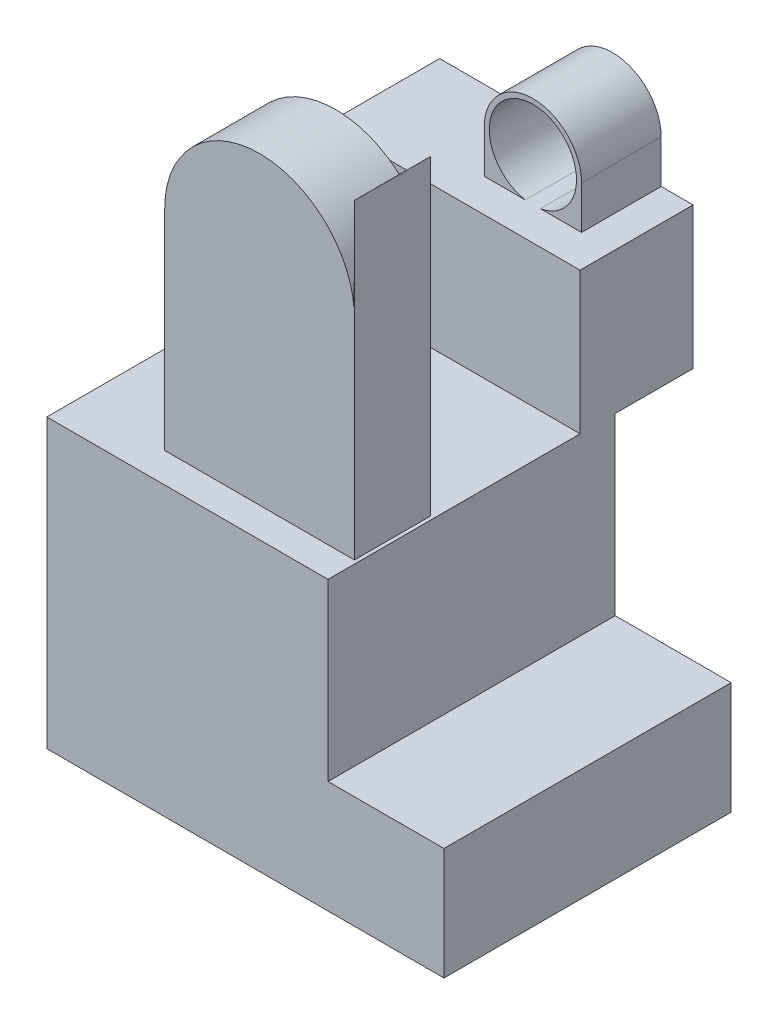
from build123d import *

# Parameters (mm, degrees)
EXTRUDE_1_DEPTH     = 72.39
SKETCH_2_W          = 63.894569667
SKETCH_2_H          = 50.584743582
EXTRUDE_2_DEPTH     = 35.72348927
SKETCH_3_W          = 47.81706323
SKETCH_3_H          = 19.199275388
EXTRUDE_4_DEPTH     = 78.486
CUT_EXTRUDE_4_DEPTH = 22.098
SKETCH_7_W          = 85.131498904
SKETCH_7_H          = 43.590498022
CUT_EXTRUDE_5_DEPTH = 22.098
EXTRUDE_5_DEPTH     = 20.066


with BuildPart() as part:
    # 草图1 → 凸台-拉伸1 (new body)
    with BuildSketch(Plane.XY):
        Polygon((30.681441224, -0.764247788), (59.9139191, -0.764247788), (59.9139191, -29.041415929), (-40.202541077, -29.041415929), (-40.202541077, -0.764247788), (-40.202541077, 43.371061947), (30.681441224, 43.371061947), align=None)
    extrude(amount=EXTRUDE_1_DEPTH)

    # 草图2 → 凸台-拉伸2 (add)
    with BuildSketch(Plane(origin=(0, 43.371061947, 0), x_dir=(1, 0, 0), z_dir=(0, 1, 0))):
        with Locations((-1.26584361, 16.441925792)):
            Rectangle(SKETCH_2_W, SKETCH_2_H)
    extrude(amount=EXTRUDE_2_DEPTH)

    # 草图3 → 凸台-拉伸4 (add)
    with BuildSketch(Plane(origin=(0, 43.371061947, 0), x_dir=(1, 0, 0), z_dir=(0, 1, 0))):
        with Locations((5.873027985, -55.236552657)):
            Rectangle(SKETCH_3_W, SKETCH_3_H)
    extrude(amount=EXTRUDE_4_DEPTH)

    # 草图6 → 切除-拉伸4 (cut)
    with BuildSketch(Plane.XY.offset(64.836190351)):
        with BuildLine():
            Line((-18.03550363, 121.857061947), (-18.03550363, 96.233075723))
            ThreePointArc((-18.03550363, 96.233075723), (5.04667963, 120.12732257), (29.724437597, 97.884784986))
            Line((29.724437597, 97.884784986), (29.774943726, 121.857061947))
            Line((29.774943726, 121.857061947), (-18.03550363, 121.857061947))
        make_face()
    extrude(amount=-CUT_EXTRUDE_4_DEPTH, mode=Mode.SUBTRACT)

    # 草图7 → 切除-拉伸5 (cut)
    with BuildSketch(Plane(origin=(0, 0, -41.734297583), x_dir=(-1, 0, 0), z_dir=(0, 0, -1))):
        with Locations((8.884308228, 58.531001223)):
            Rectangle(SKETCH_7_W, SKETCH_7_H)
    extrude(amount=-CUT_EXTRUDE_5_DEPTH, mode=Mode.SUBTRACT)

    # 草图8 → 凸台-拉伸5 (add)
    with BuildSketch(Plane(origin=(0, 0, -19.636297583), x_dir=(-1, 0, 0), z_dir=(0, 0, -1))):
        with BuildLine():
            ThreePointArc((1.878708632, 90.752463726), (-10.775595888, 102.192073522), (-22.633627477, 89.928991445))
            Line((-22.633627477, 89.928991445), (-22.633627477, 79.094551217))
            Line((-22.633627477, 79.094551217), (-12.26491781, 79.094551217))
            ThreePointArc((-12.26491781, 79.094551217), (-17.43772835, 98.352594999), (0.636372523, 89.928991445))
            ThreePointArc((0.636372523, 89.928991445), (-1.940023923, 82.854890572), (-8.462337143, 79.094551217))
            Line((-8.462337143, 79.094551217), (1.899704254, 79.094551217))
            Line((1.899704254, 79.094551217), (1.881595314, 89.149620673))
            Line((1.881595314, 89.149620673), (1.878708632, 90.752463726))
        make_face()
        with BuildLine():
            Line((-12.26491781, 79.094551217), (-22.633627477, 79.094551217))
            Line((-22.633627477, 79.094551217), (-22.633627477, 75.391965029))
            Line((-22.633627477, 75.391965029), (1.906372523, 75.391965029))
            Line((1.906372523, 75.391965029), (1.899704254, 79.094551217))
            Line((1.899704254, 79.094551217), (-8.462337143, 79.094551217))
            ThreePointArc((-8.462337143, 79.094551217), (-10.363627477, 78.928991445), (-12.26491781, 79.094551217))
        make_face()
    extrude(amount=-EXTRUDE_5_DEPTH)


solid = part.part
